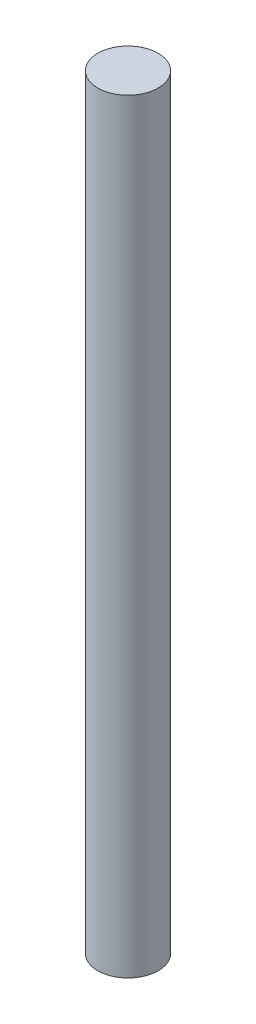
from build123d import *

# Parameters (mm, degrees)
SKETCH_1_R      = 1.5
EXTRUDE_1_DEPTH = 38


with BuildPart() as part:
    # 草图1 → 凸台-拉伸1 (new body)
    with BuildSketch(Plane(origin=(0, 0, 0), x_dir=(1, 0, 0), z_dir=(0, 1, 0))):
        with Locations(Location((0, 0, 0), (0, 0, 270))):
            Circle(SKETCH_1_R)
    extrude(amount=EXTRUDE_1_DEPTH)


solid = part.part
